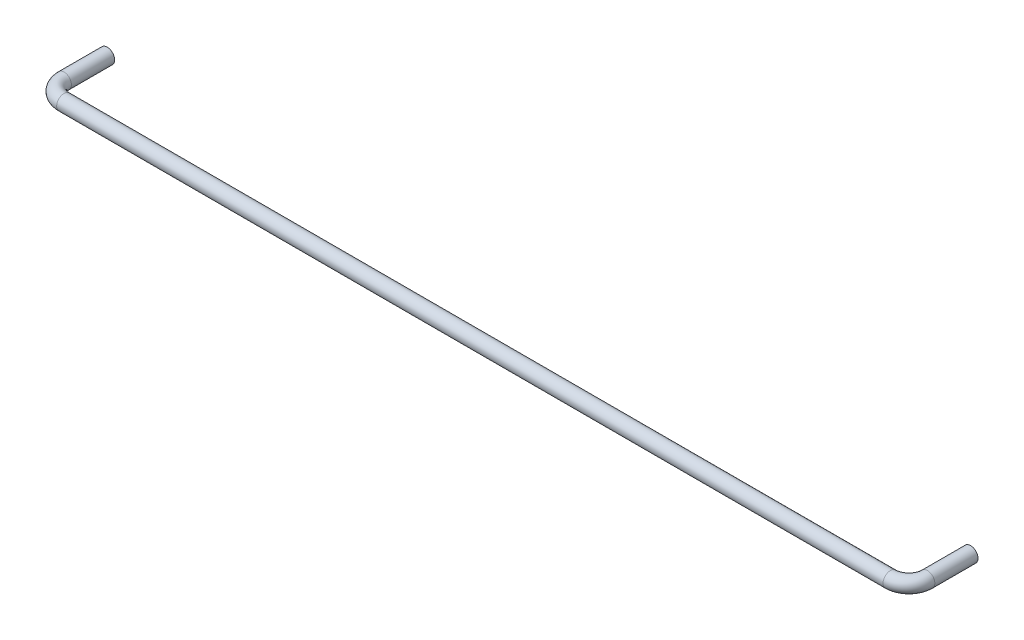
from build123d import *

# Parameters (mm, degrees)
SKETCH3_R = 0.6


with BuildPart() as part:
    # Sweep1: sweep along a path in Sketch2
    with BuildLine(Plane(origin=(0, 0, 0), x_dir=(1, 0, 0), z_dir=(0, 1, 0))) as sweep1_path:
        Line((70, 0), (70, -3.5))
        ThreePointArc((70, -3.5), (69.560660172, -4.560660172), (68.5, -5))
        Line((68.5, -5), (1.5, -5))
        ThreePointArc((1.5, -5), (0.439339828, -4.560660172), (0, -3.5))
        Line((0, -3.5), (0, 0))
    # Sketch3 → Sweep1 (sweep)
    with BuildSketch(Plane.XY):
        Circle(SKETCH3_R)
    sweep(path=sweep1_path.line)


solid = part.part
